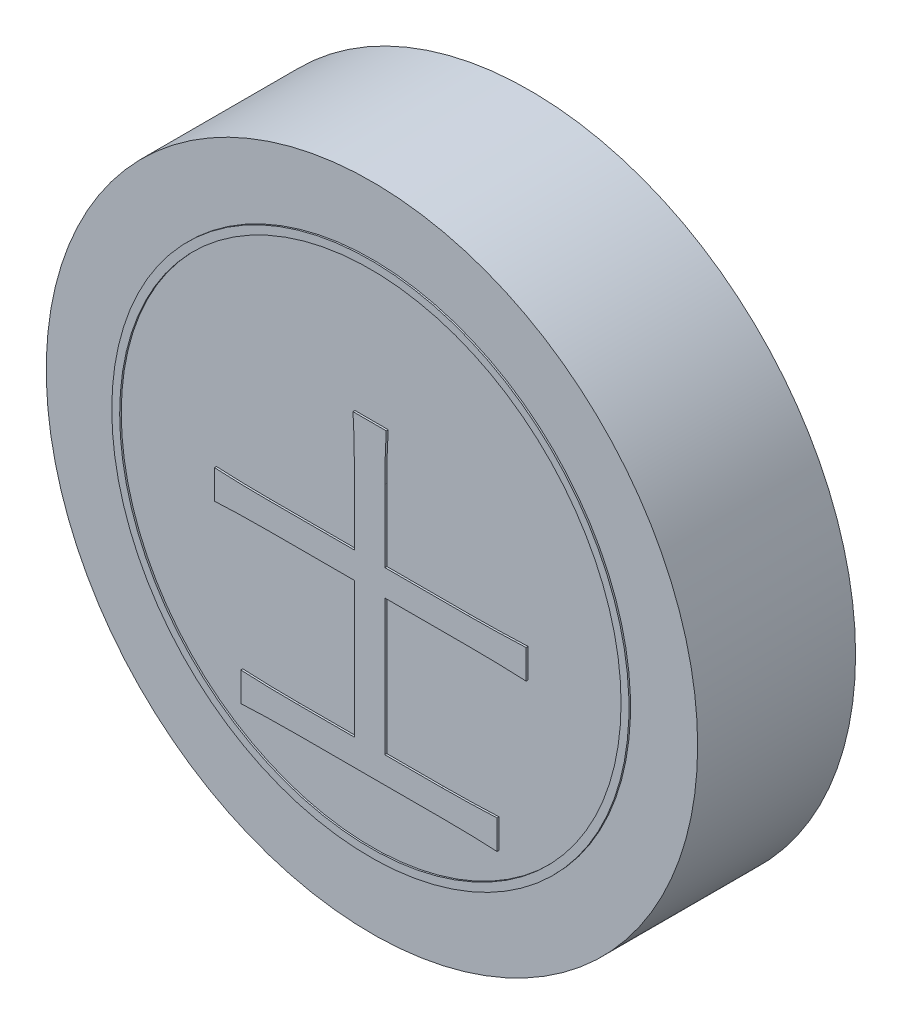
from build123d import *

# Parameters (mm, degrees)
SKETCH_1_R               = 16.5
DIAMETER33_HEIGHT8_DEPTH = 8
CHARACTER_DEPTH          = 0.1
SKETCH_3_R               = 13.1
SKETCH_3_R_2             = 12.7
INK_RING_DEPTH           = 0.08


with BuildPart() as part:
    # 草图1 → Diameter33_Height8 (new body)
    with BuildSketch(Plane.XY):
        Circle(SKETCH_1_R)
    extrude(amount=-DIAMETER33_HEIGHT8_DEPTH)

    # 草图2 → Character_士 (add)
    with BuildSketch(Plane.XY):
        with BuildLine():
            add(Edge.make_bspline(
                [(0.824561404, 6.026315789), (0.813336636, 5.83662132), (0.790538423, 5.45133988), (0.771428603, 4.863755794), (0.757740418, 4.258132362), (0.755515021, 3.84828648), (0.754385965, 3.640350877)],
                knots=[0, 0, 0, 0, 0.955126267, 1.939921735, 2.954817811, 4, 4, 4, 4], degree=3))
            Line((0.754385965, 3.640350877), (0.754385965, -0.00877193))
            Line((0.754385965, -0.00877193), (4.964912281, -0.00877193))
            add(Edge.make_bspline(
                [(4.964912281, -0.00877193), (5.184108112, -0.007529011), (5.640726, -0.004939824), (6.351162704, 0.009012072), (7.114519154, 0.028890494), (7.640265954, 0.050317465), (7.912280702, 0.061403509)],
                knots=[0, 0, 0, 0, 0.89213577, 1.858452998, 2.891990654, 4, 4, 4, 4], degree=3))
            Line((7.912280702, 0.061403509), (7.912280702, -1.412280702))
            add(Edge.make_bspline(
                [(7.912280702, -1.412280702), (7.427185378, -1.392141242), (6.468519002, -1.352340771), (5.509053521, -1.345489646), (5.035087719, -1.342105263)],
                knots=[0, 0, 0, 0, 1.012021148, 2, 2, 2, 2], degree=3))
            Line((5.035087719, -1.342105263), (0.754385965, -1.342105263))
            Line((0.754385965, -1.342105263), (0.754385965, -8.219298246))
            Line((0.754385965, -8.219298246), (3.631578947, -8.219298246))
            add(Edge.make_bspline(
                [(3.631578947, -8.219298246), (3.848176317, -8.218087826), (4.292668001, -8.215603856), (4.977115293, -8.20161515), (5.696306453, -8.181989949), (6.187377565, -8.160246287), (6.438596491, -8.149122807)],
                knots=[0, 0, 0, 0, 0.925596292, 1.899468382, 2.925423867, 4, 4, 4, 4], degree=3))
            Line((6.438596491, -8.149122807), (6.438596491, -9.622807018))
            add(Edge.make_bspline(
                [(6.438596491, -9.622807018), (6.22377323, -9.611572963), (5.785618359, -9.588659914), (5.114015233, -9.569582266), (4.416560018, -9.555980066), (3.942610691, -9.553759864), (3.701754386, -9.552631579)],
                knots=[0, 0, 0, 0, 0.942753637, 1.922846234, 2.944411245, 4, 4, 4, 4], degree=3))
            Line((3.701754386, -9.552631579), (-3.666666667, -9.552631579))
            add(Edge.make_bspline(
                [(-3.666666667, -9.552631579), (-3.919651707, -9.553757661), (-4.416990585, -9.555971406), (-5.149099093, -9.569586009), (-5.855343836, -9.588750323), (-6.316905199, -9.61158096), (-6.543859649, -9.622807018)],
                knots=[0, 0, 0, 0, 1.05470571, 2.07342756, 3.052684594, 4, 4, 4, 4], degree=3))
            Line((-6.543859649, -9.622807018), (-6.543859649, -8.149122807))
            add(Edge.make_bspline(
                [(-6.543859649, -8.149122807), (-6.326438065, -8.160395624), (-5.876165846, -8.183741218), (-5.178554503, -8.202420094), (-4.436918096, -8.216076814), (-3.928315814, -8.218203947), (-3.666666667, -8.219298246)],
                knots=[0, 0, 0, 0, 0.907617697, 1.879643343, 2.909187922, 4, 4, 4, 4], degree=3))
            Line((-3.666666667, -8.219298246), (-0.789473684, -8.219298246))
            Line((-0.789473684, -8.219298246), (-0.789473684, -1.342105263))
            Line((-0.789473684, -1.342105263), (-5.140350877, -1.342105263))
            add(Edge.make_bspline(
                [(-5.140350877, -1.342105263), (-5.390737734, -1.343192376), (-5.875950755, -1.345299041), (-6.582068481, -1.358952048), (-7.244168345, -1.377670192), (-7.671036038, -1.401009107), (-7.877192982, -1.412280702)],
                knots=[0, 0, 0, 0, 1.097340975, 2.126485934, 3.095181147, 4, 4, 4, 4], degree=3))
            Line((-7.877192982, -1.412280702), (-7.877192982, 0.061403509))
            add(Edge.make_bspline(
                [(-7.877192982, 0.061403509), (-7.671036038, 0.050131914), (-7.244168345, 0.026792999), (-6.582068481, 0.008074855), (-5.875950755, -0.005578152), (-5.390737734, -0.007684817), (-5.140350877, -0.00877193)],
                knots=[0, 0, 0, 0, 0.904818853, 1.873514066, 2.902659025, 4, 4, 4, 4], degree=3))
            Line((-5.140350877, -0.00877193), (-0.789473684, -0.00877193))
            Line((-0.789473684, -0.00877193), (-0.789473684, 3.640350877))
            add(Edge.make_bspline(
                [(-0.789473684, 3.640350877), (-0.790602741, 3.84828648), (-0.792828137, 4.258132362), (-0.806516322, 4.863755794), (-0.825626143, 5.45133988), (-0.848424355, 5.83662132), (-0.859649123, 6.026315789)],
                knots=[0, 0, 0, 0, 1.045182189, 2.060078265, 3.044873733, 4, 4, 4, 4], degree=3))
            Line((-0.859649123, 6.026315789), (0.824561404, 6.026315789))
        make_face()
    extrude(amount=CHARACTER_DEPTH)

    # 草图3 → Ink_ring (add)
    with BuildSketch(Plane.XY):
        with Locations(Location((0, 0, 0), (0, 0, 180))):
            Circle(SKETCH_3_R)
        with Locations(Location((0, 0, 0), (0, 0, 180))):
            Circle(SKETCH_3_R_2, mode=Mode.SUBTRACT)
    extrude(amount=INK_RING_DEPTH)


solid = part.part
